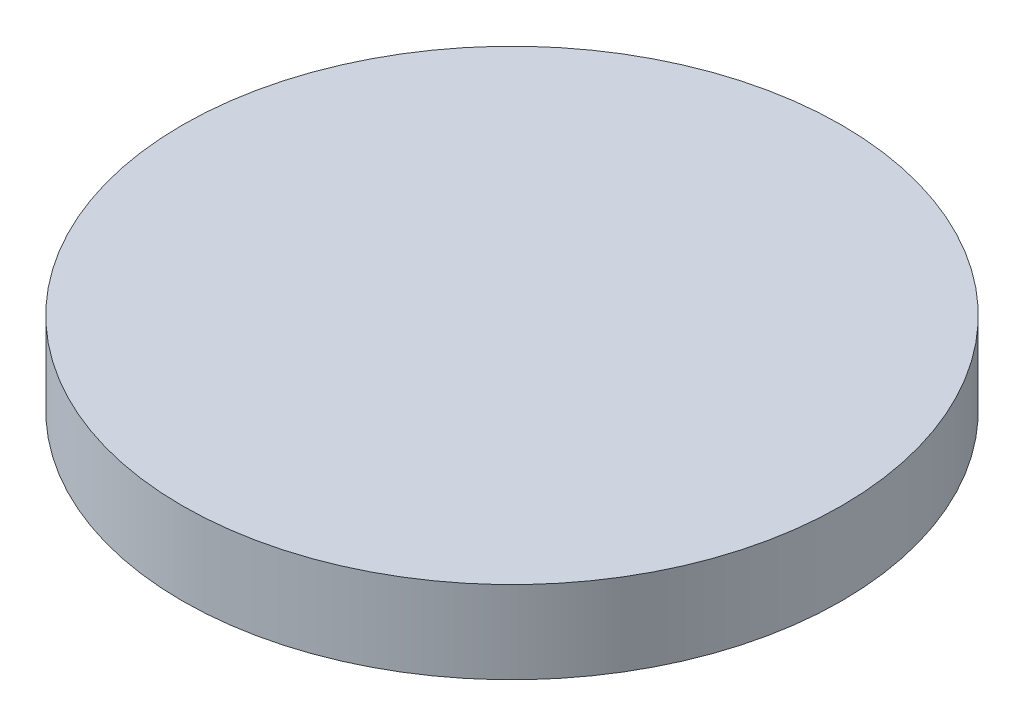
from build123d import *

# Parameters (mm, degrees)
SKETCH1_R           = 101.6
BOSS_EXTRUDE1_DEPTH = 25.4
SKETCH2_R           = 19.05
BOSS_EXTRUDE2_DEPTH = 50.8
SKETCH3_R           = 12.7
CUT_EXTRUDE1_DEPTH  = 50.8


with BuildPart() as part:
    # Sketch1 → Boss-Extrude1 (new body)
    with BuildSketch(Plane(origin=(0, 0, 0), x_dir=(1, 0, 0), z_dir=(0, 1, 0))):
        with Locations(Location((0, 0, 0), (0, 0, 270))):
            Circle(SKETCH1_R)
    extrude(amount=BOSS_EXTRUDE1_DEPTH)

    # Sketch2 → Boss-Extrude2 (add)
    with BuildSketch(Plane.XZ):
        with Locations(Location((0, 0, 0), (0, 0, 270))):
            Circle(SKETCH2_R)
    extrude(amount=BOSS_EXTRUDE2_DEPTH)

    # Sketch3 → Cut-Extrude1 (cut)
    with BuildSketch(Plane.XZ.offset(50.8)):
        with Locations(Location((0, 0, 0), (0, 0, 270))):
            Circle(SKETCH3_R)
    extrude(amount=-CUT_EXTRUDE1_DEPTH, mode=Mode.SUBTRACT)


solid = part.part
